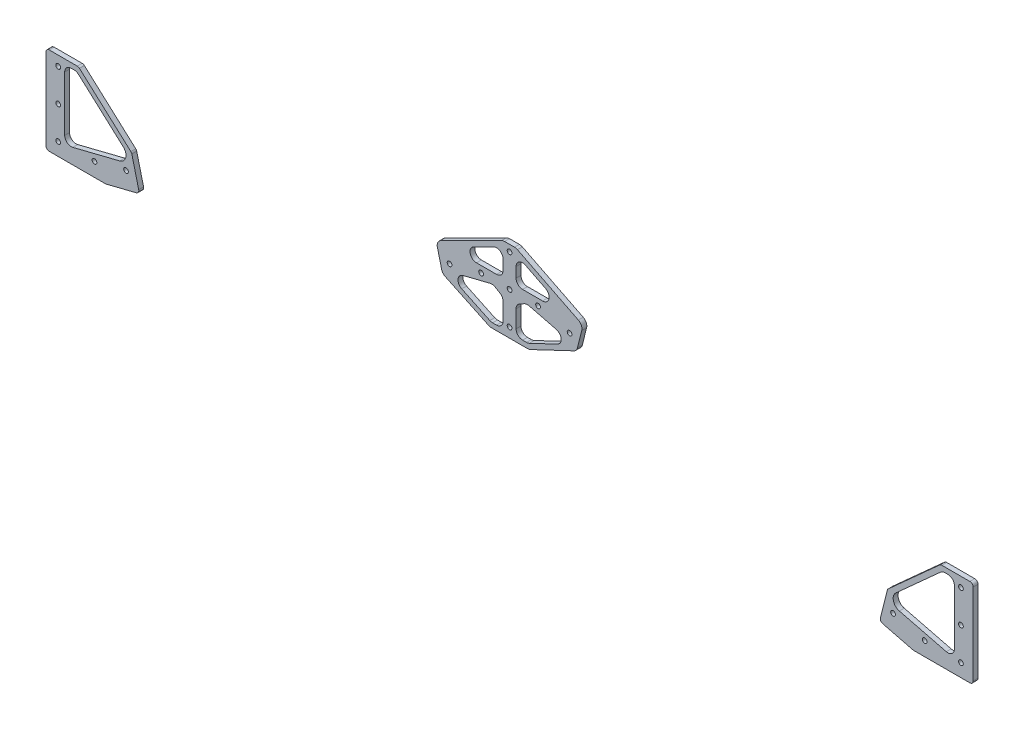
from build123d import *

# Parameters (mm, degrees)
SKETCH_1_R        = 1.45
EXTRUDE_1_DEPTH   = 3
EXTRUDE_1_2_DEPTH = 3
FILLET_1_R        = 4
FILLET_2_R        = 4
FILLET_3_R        = 4
FILLET_4_R        = 2
FILLET_5_R        = 2
FILLET_6_R        = 4


with BuildPart() as part:
    # 草图1 → 凸台-拉伸1 (new body)
    with BuildSketch(Plane.XY):
        Polygon((0, 2), (-7.5, 2), (-7.5, 56), (12.5, 56), (45.113436218, 26.586123118), (49.964148719, 7.183273116), (29.231056256, 2), align=None)
        with Locations((0, 30)):
            Circle(SKETCH_1_R, mode=Mode.SUBTRACT)
        with Locations((0, 10)):
            Circle(SKETCH_1_R, mode=Mode.SUBTRACT)
        with Locations((0, 50)):
            Circle(SKETCH_1_R, mode=Mode.SUBTRACT)
        with Locations((22.315087464, 10.578771866)):
            Circle(SKETCH_1_R, mode=Mode.SUBTRACT)
        with Locations((41.717937467, 15.429484367)):
            Circle(SKETCH_1_R, mode=Mode.SUBTRACT)
        with BuildLine():
            Line((4, 53), (4, 10.123105626))
            Line((4, 10.123105626), (37.868510171, 18.590233168))
            ThreePointArc((37.868510171, 18.590233168), (41.507195793, 22.23087551), (40.00454007, 27.153916794))
            Line((40.00454007, 27.153916794), (11.346992154, 53))
            Line((11.346992154, 53), (4, 53))
        make_face(mode=Mode.SUBTRACT)
    extrude(amount=EXTRUDE_1_DEPTH)


with BuildPart() as body_2:
    # 草图1 → Extrude 1 2 (new body)
    with BuildSketch(Plane.XY):
        Polygon((277.5, 44), (265.5, 44), (236.231508746, 57.873218748), (232.350938746, 73.395498751), (273.5, 94), (281.5, 94), (281.5, 44), align=None)
        with Locations((277.5, 70)):
            Circle(SKETCH_1_R, mode=Mode.SUBTRACT)
        with Locations((277.5, 50)):
            Circle(SKETCH_1_R, mode=Mode.SUBTRACT)
        with Locations((277.5, 90)):
            Circle(SKETCH_1_R, mode=Mode.SUBTRACT)
        with Locations((260, 70)):
            Circle(SKETCH_1_R, mode=Mode.SUBTRACT)
        with Locations((240.597149997, 65.149287499)):
            Circle(SKETCH_1_R, mode=Mode.SUBTRACT)
        Polygon((273.5, 64), (273.5, 47), (266.175003056, 47), (237.969630722, 60.369302055), (267.152151247, 67.664932186), align=None, mode=Mode.SUBTRACT)
        Polygon((273.5, 90.64492029), (273.5, 74), (240.258581715, 74), align=None, mode=Mode.SUBTRACT)
    extrude(amount=EXTRUDE_1_2_DEPTH)


with BuildPart() as body_3:
    # 镜向4: mirrored copy
    add(part.part.mirror(Plane.ZY.offset(-277.5)))

    # 圆角3
    fillet_3_edges = [body_3.edges().sort_by_distance(p)[0] for p in [
        (543.653007846, 53, 1.5),
        (551, 10.123105626, 1.5),
        (551, 53, 1.5),
    ]]
    fillet(fillet_3_edges, radius=FILLET_3_R)

    # 圆角5
    fillet_5_edges = [body_3.edges().sort_by_distance(p)[0] for p in [
        (525.768943744, 2, 1.5),
        (509.886563782, 26.586123118, 1.5),
        (542.5, 56, 1.5),
        (562.5, 56, 1.5),
        (562.5, 2, 1.5),
        (505.035851281, 7.183273116, 1.5),
    ]]
    fillet(fillet_5_edges, radius=FILLET_5_R)


with BuildPart() as body_4:
    # Mirror 4 2: mirrored copy
    add(body_2.part.mirror(Plane.ZY.offset(-277.5)))


with BuildPart() as body_2_1:
    add(body_2.part)

    # Combine 4: union body 4
    add(body_4.part)

    # 圆角2
    fillet_2_edges = [body_2_1.edges().sort_by_distance(p)[0] for p in [
        (314.741418285, 74, 1.5),
        (281.5, 90.64492029, 1.5),
        (281.5, 74, 1.5),
        (288.824996944, 47, 1.5),
        (317.030369278, 60.369302055, 1.5),
        (287.847848753, 67.664932186, 1.5),
        (281.5, 47, 1.5),
        (273.5, 90.64492029, 1.5),
        (240.258581715, 74, 1.5),
        (273.5, 74, 1.5),
        (273.5, 64, 1.5),
        (267.152151247, 67.664932186, 1.5),
        (237.969630722, 60.369302055, 1.5),
        (266.175003056, 47, 1.5),
        (273.5, 47, 1.5),
        (281.5, 64, 1.5),
    ]]
    fillet(fillet_2_edges, radius=FILLET_2_R)

    # 圆角6
    fillet_6_edges = [body_2_1.edges().sort_by_distance(p)[0] for p in [
        (265.5, 44, 1.5),
        (232.350938746, 73.395498751, 1.5),
        (273.5, 94, 1.5),
        (281.5, 94, 1.5),
        (322.649061254, 73.395498751, 1.5),
        (318.768491254, 57.873218748, 1.5),
        (289.5, 44, 1.5),
        (236.231508746, 57.873218748, 1.5),
    ]]
    fillet(fillet_6_edges, radius=FILLET_6_R)


with BuildPart() as part_1:
    add(part.part)

    # 圆角1
    fillet_1_edges = [part_1.edges().sort_by_distance(p)[0] for p in [
        (4, 53, 1.5),
        (11.346992154, 53, 1.5),
        (4, 10.123105626, 1.5),
    ]]
    fillet(fillet_1_edges, radius=FILLET_1_R)

    # 圆角4
    fillet_4_edges = [part_1.edges().sort_by_distance(p)[0] for p in [
        (-7.5, 56, 1.5),
        (12.5, 56, 1.5),
        (45.113436218, 26.586123118, 1.5),
        (49.964148719, 7.183273116, 1.5),
        (29.231056256, 2, 1.5),
        (-7.5, 2, 1.5),
    ]]
    fillet(fillet_4_edges, radius=FILLET_4_R)


solid = Compound([body_3.part, body_2_1.part, part_1.part])
